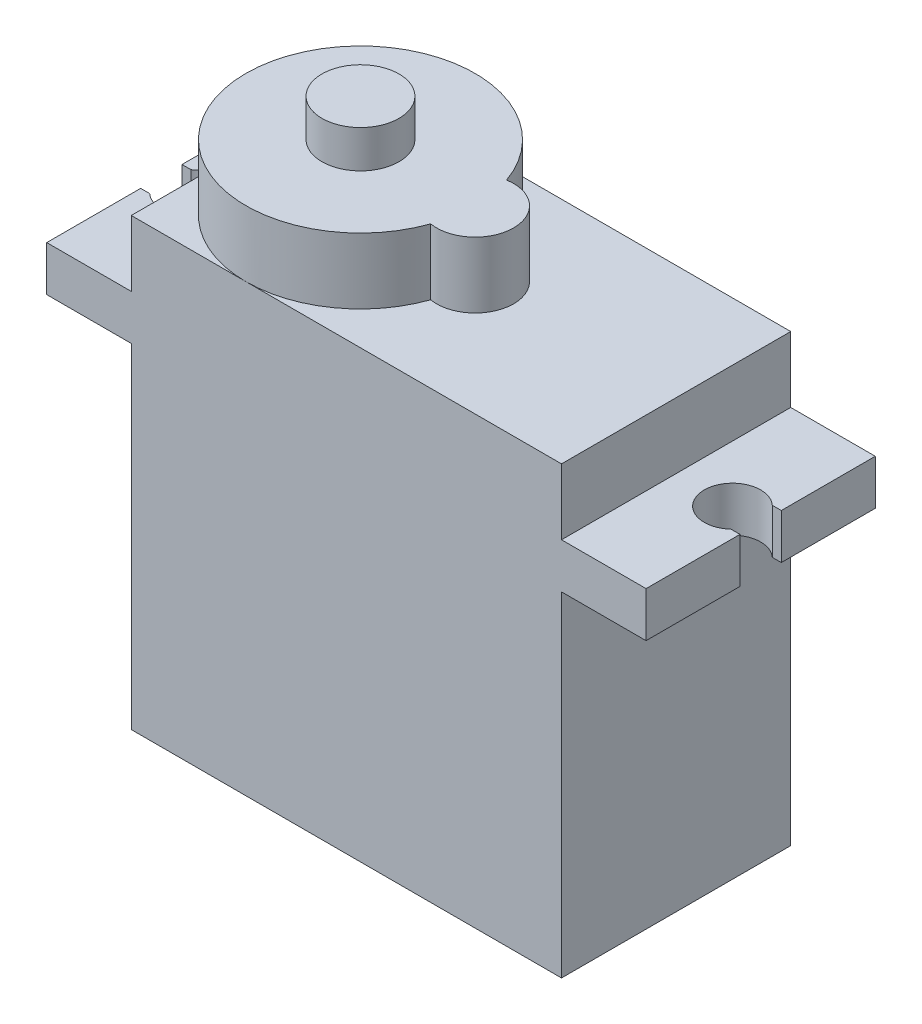
from build123d import *

# Parameters (mm, degrees)
CROQUIS1_W              = 22.9
CROQUIS1_H              = 23.7
CROQUIS1_W_2            = 4.5
CROQUIS1_H_2            = 2.4
SALIENTE_EXTRUIR1_DEPTH = 12.2
CROQUIS2_R              = 6.1
CROQUIS2_R_2            = 2.05
SALIENTE_EXTRUIR2_DEPTH = 3.5
SALIENTE_EXTRUIR3_START = 3.5
CROQUIS2_3_R            = 2.05
SALIENTE_EXTRUIR3_DEPTH = 2
CORTAR_EXTRUIR2_REACH   = 30.483
CROQUIS3_R              = 1.5


with BuildPart() as part:
    # Croquis1 → Saliente-Extruir1 (new body)
    with BuildSketch(Plane.XY):
        Rectangle(CROQUIS1_W, CROQUIS1_H)
        with Locations((-13.7, 7.15)):
            Rectangle(CROQUIS1_W_2, CROQUIS1_H_2)
        with Locations((13.7, 7.15)):
            Rectangle(CROQUIS1_W_2, CROQUIS1_H_2)
    extrude(amount=SALIENTE_EXTRUIR1_DEPTH)

    # Croquis2 → Saliente-Extruir2 (add)
    # profile 1 of 3: a face of its own
    with BuildSketch(Plane(origin=(0, 11.85, 0), x_dir=(1, 0, 0), z_dir=(0, 1, 0))):
        with BuildLine():
            ThreePointArc((0.405532787, -4.079148115), (0.663266583, -5.075), (0.75, -6.1))
            ThreePointArc((0.75, -6.1), (0.663266583, -7.125), (0.405532787, -8.120851885))
            ThreePointArc((0.405532787, -8.120851885), (2.8, -6.1), (0.405532787, -4.079148115))
        make_face()
    # profile 2 of 3: a face of its own
    with BuildSketch(Plane(origin=(0, 11.85, 0), x_dir=(1, 0, 0), z_dir=(0, 1, 0))):
        with Locations((-5.35, -6.1)):
            Circle(CROQUIS2_R)
        with Locations((-5.35, -6.1)):
            Circle(CROQUIS2_R_2, mode=Mode.SUBTRACT)
    # profile 3 of 3: a face of its own
    with BuildSketch(Plane(origin=(0, 11.85, 0), x_dir=(1, 0, 0), z_dir=(0, 1, 0))):
        with Locations((-5.35, -6.1)):
            Circle(CROQUIS2_R_2)
    extrude(amount=SALIENTE_EXTRUIR2_DEPTH)

    # Croquis2<3> → Saliente-Extruir3 (add)
    with BuildSketch(Plane(origin=(0, 11.85, 0), x_dir=(1, 0, 0), z_dir=(0, 1, 0)).offset(SALIENTE_EXTRUIR3_START)):
        with Locations(Location((-5.35, -6.1, 0), (0, 0, 270))):
            Circle(CROQUIS2_3_R)
    extrude(amount=SALIENTE_EXTRUIR3_DEPTH)

    # Croquis3 → Cortar-Extruir2 (cut, up to next)
    with BuildSketch(Plane(origin=(0, 8.35, 0), x_dir=(1, 0, 0), z_dir=(0, 1, 0)), mode=Mode.PRIVATE) as cortar_extruir2_sk1:
        with Locations((-14.45, -6.1)):
            Circle(CROQUIS3_R)
    cortar_extruir2_tool1 = extrude(cortar_extruir2_sk1.sketch, amount=-CORTAR_EXTRUIR2_REACH, mode=Mode.PRIVATE) & part.part
    # Croquis3 → Cortar-Extruir2 (cut, up to next)
    with BuildSketch(Plane(origin=(0, 8.35, 0), x_dir=(1, 0, 0), z_dir=(0, 1, 0)), mode=Mode.PRIVATE) as cortar_extruir2_sk2:
        with BuildLine():
            ThreePointArc((-15.469803903, -7.2), (-15.824719218, -6.700122548), (-15.95, -6.1))
            Line((-15.95, -6.1), (-15.95, -7.2))
            Line((-15.95, -7.2), (-15.469803903, -7.2))
        make_face()
    cortar_extruir2_tool2 = extrude(cortar_extruir2_sk2.sketch, amount=-CORTAR_EXTRUIR2_REACH, mode=Mode.PRIVATE) & part.part
    # Croquis3 → Cortar-Extruir2 (cut, up to next)
    with BuildSketch(Plane(origin=(0, 8.35, 0), x_dir=(1, 0, 0), z_dir=(0, 1, 0)), mode=Mode.PRIVATE) as cortar_extruir2_sk3:
        with BuildLine():
            Line((-15.469803903, -5), (-15.95, -5))
            Line((-15.95, -5), (-15.95, -6.1))
            ThreePointArc((-15.95, -6.1), (-15.824719218, -5.499877452), (-15.469803903, -5))
        make_face()
    cortar_extruir2_tool3 = extrude(cortar_extruir2_sk3.sketch, amount=-CORTAR_EXTRUIR2_REACH, mode=Mode.PRIVATE) & part.part
    cortar_extruir2_1 = cortar_extruir2_tool1.solids().sort_by_distance((-14.45, 8.35, 6.1))[0]
    add(cortar_extruir2_1, mode=Mode.SUBTRACT)
    cortar_extruir2_2 = cortar_extruir2_tool2.solids().sort_by_distance((-15.810988, 8.35, 6.934581))[0]
    add(cortar_extruir2_2, mode=Mode.SUBTRACT)
    cortar_extruir2_3 = cortar_extruir2_tool3.solids().sort_by_distance((-15.810988, 8.35, 5.265419))[0]
    add(cortar_extruir2_3, mode=Mode.SUBTRACT)
    cortar_extruir2 = cortar_extruir2_1 + cortar_extruir2_2 + cortar_extruir2_3  # Cortar-Extruir2 as one shape, for the pattern or mirror that repeats it

    # Simetría1: Cortar-Extruir2 across plane
    add(cortar_extruir2.mirror(Plane(origin=(0, 0, 0), x_dir=(0, 0, 1), z_dir=(1, 0, 0))), mode=Mode.SUBTRACT)


solid = part.part
